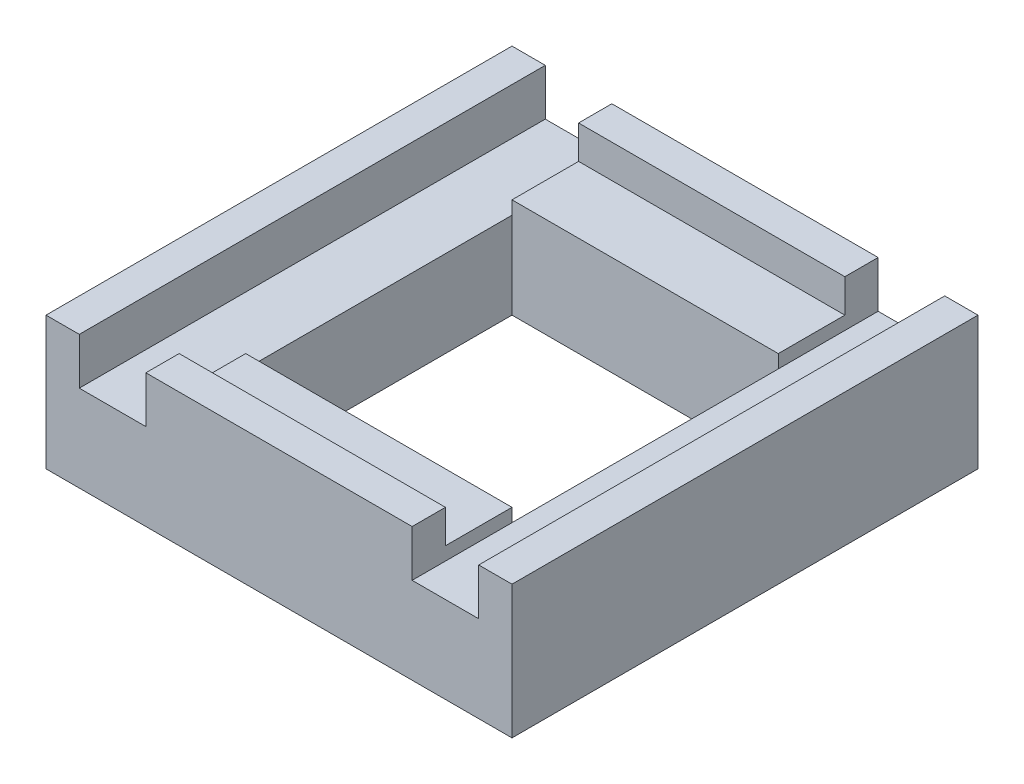
from build123d import *

# Parameters (mm, degrees)
CROQUIS1_W                 = 70
CROQUIS1_H                 = 70
SALIENTE_EXTRUIR1_DEPTH    = 20
CROQUIS2_W                 = 60
CROQUIS2_H                 = 60
CORTAR_EXTRUIR1_DEPTH      = 5
CORTAR_EXTRUIR2_DEPTH      = 5
CORTAR_EXTRUIR2_DEPTH_BACK = 2
CROQUIS3_W                 = 10
CROQUIS3_H                 = 70
CROQUIS4_W                 = 40
CROQUIS4_H                 = 40
CORTAR_EXTRUIR3_DEPTH      = 52


with BuildPart() as part:
    # Croquis1 → Saliente-Extruir1 (new body)
    with BuildSketch(Plane(origin=(0, 0, 0), x_dir=(1, 0, 0), z_dir=(0, 1, 0))):
        with Locations((35, 35)):
            Rectangle(CROQUIS1_W, CROQUIS1_H)
    extrude(amount=SALIENTE_EXTRUIR1_DEPTH)

    # Croquis2 → Cortar-Extruir1 (cut)
    with BuildSketch(Plane(origin=(0, 20, 0), x_dir=(1, 0, 0), z_dir=(0, 1, 0))):
        with Locations((35, 35)):
            Rectangle(CROQUIS2_W, CROQUIS2_H)
    extrude(amount=-CORTAR_EXTRUIR1_DEPTH, mode=Mode.SUBTRACT)

    # Croquis3 → Cortar-Extruir2 (cut, two sides: drawn at the far end of the back side and taken through both)
    with BuildSketch(Plane(origin=(0, 15, 0), x_dir=(1, 0, 0), z_dir=(0, 1, 0)).offset(-CORTAR_EXTRUIR2_DEPTH_BACK)):
        with Locations((10, 35)):
            Rectangle(CROQUIS3_W, CROQUIS3_H)
        with Locations((60, 35)):
            Rectangle(CROQUIS3_W, CROQUIS3_H)
    extrude(amount=CORTAR_EXTRUIR2_DEPTH + CORTAR_EXTRUIR2_DEPTH_BACK, mode=Mode.SUBTRACT)

    # Croquis4 → Cortar-Extruir3 (cut)
    with BuildSketch(Plane(origin=(0, 15, 0), x_dir=(1, 0, 0), z_dir=(0, 1, 0))):
        with Locations((35, 35)):
            Rectangle(CROQUIS4_W, CROQUIS4_H)
    extrude(amount=-CORTAR_EXTRUIR3_DEPTH, mode=Mode.SUBTRACT)


solid = part.part
